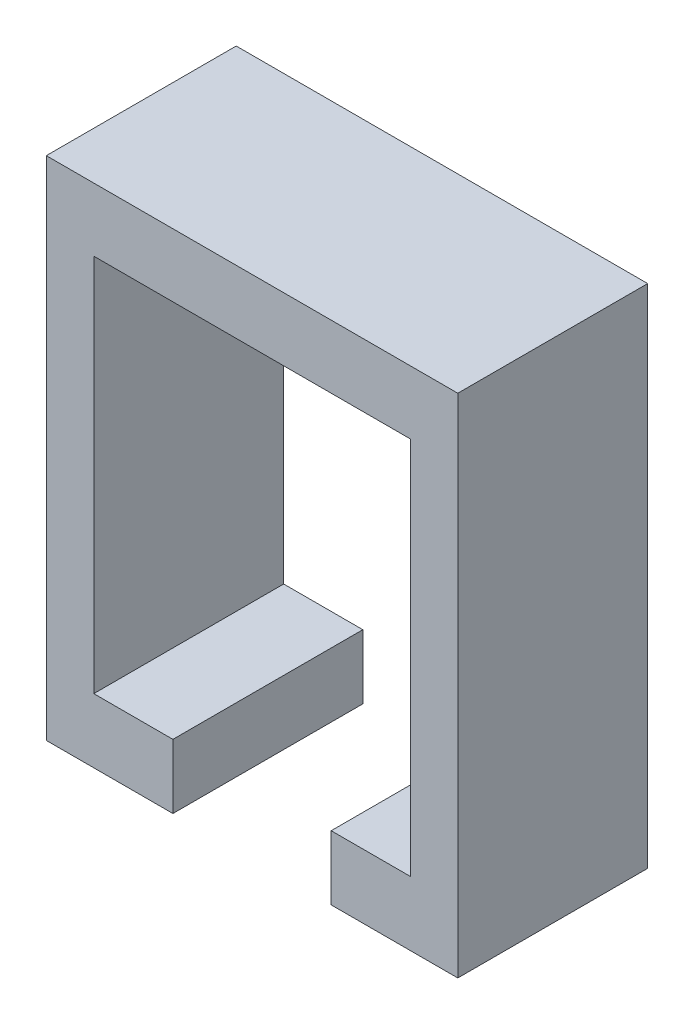
from build123d import *

# Parameters (mm, degrees)
BOSS_EXTRUDE1_DEPTH = 6


with BuildPart() as part:
    # Sketch1 → Boss-Extrude1 (new body)
    with BuildSketch(Plane.XY):
        Polygon((-5, -2), (-5, -13.97), (-2.5, -13.97), (-2.5, -16), (-6.5, -16), (-6.5, 0), (6.5, 0), (6.5, -16), (2.5, -16), (2.5, -13.97), (5, -13.97), (5, -2), align=None)
    extrude(amount=BOSS_EXTRUDE1_DEPTH)


solid = part.part
